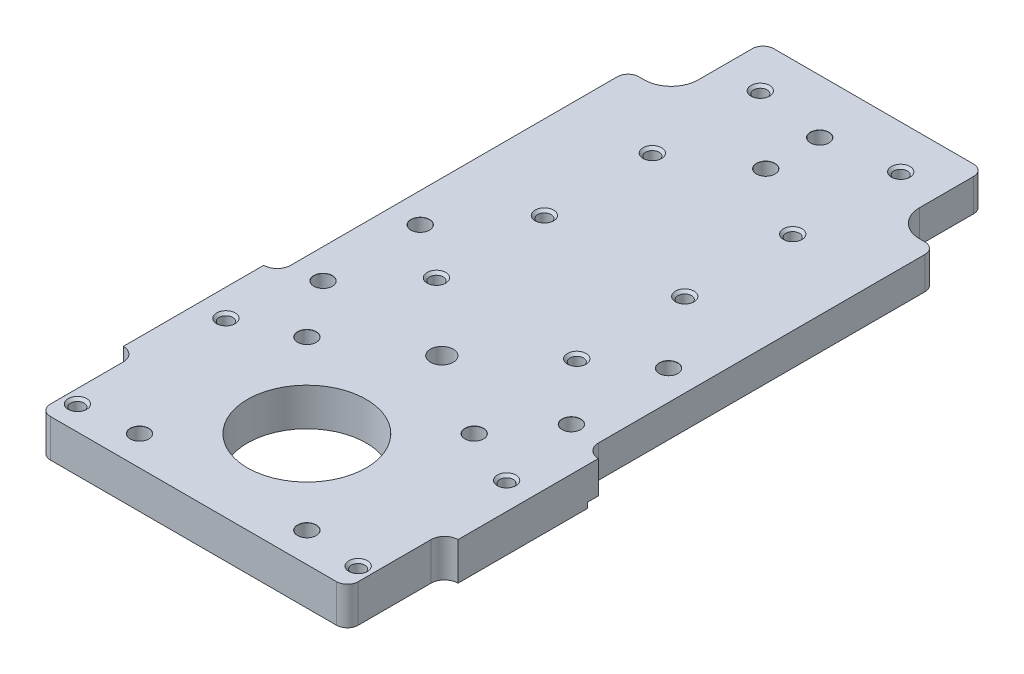
from build123d import *

# Parameters (mm, degrees)
PLATE_MAIN_SKETCH_R             = 11
PLATE_MAIN_SKETCH_R_2           = 2.111650326
EXTRUDE_PLATE_MAIN_DEPTH        = 7
FILLET1_R                       = 2
M3X0_5_TAPPED_HOLE3_AT_2_COUNT  = 2
M3X0_5_TAPPED_HOLE3_AT_2_PITCH  = 27.5
M3X0_5_TAPPED_HOLE3_AT_3_COUNT  = 2
M3X0_5_TAPPED_HOLE3_AT_3_PITCH  = 58.823889705
M3X0_5_TAPPED_HOLE3_AT_4_COUNT  = 2
M3X0_5_TAPPED_HOLE3_AT_4_PITCH  = 66.206117542
M3X0_5_TAPPED_HOLE3_AT_5_COUNT  = 2
M3X0_5_TAPPED_HOLE3_AT_5_PITCH  = 83.20606949
M3X0_5_TAPPED_HOLE3_AT_6_COUNT  = 2
M3X0_5_TAPPED_HOLE3_AT_6_PITCH  = 101.307699609
M3X0_5_TAPPED_HOLE3_AT_7_COUNT  = 2
M3X0_5_TAPPED_HOLE3_AT_7_PITCH  = 120.013540903
M3X0_5_TAPPED_HOLE3_AT_8_COUNT  = 2
M3X0_5_TAPPED_HOLE3_AT_8_PITCH  = 114.242067558
M3X0_5_TAPPED_HOLE3_AT_9_COUNT  = 2
M3X0_5_TAPPED_HOLE3_AT_9_PITCH  = 94.399417371
M3X0_5_TAPPED_HOLE3_AT_10_COUNT = 2
M3X0_5_TAPPED_HOLE3_AT_10_PITCH = 74.640806534
M3X0_5_TAPPED_HOLE3_AT_11_COUNT = 2
M3X0_5_TAPPED_HOLE3_AT_11_PITCH = 55.056788864
M3X0_5_TAPPED_HOLE3_AT_12_COUNT = 2
M3X0_5_TAPPED_HOLE3_AT_12_PITCH = 52
CBORE_FOR_M3_SHCS1_AT_2_COUNT   = 2
CBORE_FOR_M3_SHCS1_AT_2_PITCH   = 31
CBORE_FOR_M3_SHCS1_AT_3_COUNT   = 2
CBORE_FOR_M3_SHCS1_AT_3_PITCH   = 43.840620434
CBORE_FOR_M3_SHCS1_AT_4_COUNT   = 2
CBORE_FOR_M3_SHCS1_AT_4_PITCH   = 31
CBORE_FOR_M3_SHCS1_AT_5_COUNT   = 2
CBORE_FOR_M3_SHCS1_AT_5_PITCH   = 42.172265768
CBORE_FOR_M3_SHCS1_AT_6_COUNT   = 2
CBORE_FOR_M3_SHCS1_AT_6_PITCH   = 56.608303278
CBORE_FOR_M3_SHCS1_AT_7_COUNT   = 2
CBORE_FOR_M3_SHCS1_AT_7_PITCH   = 70.86959856
CBORE_FOR_M3_SHCS1_AT_8_COUNT   = 2
CBORE_FOR_M3_SHCS1_AT_8_PITCH   = 59.970826241
CBORE_FOR_M3_SHCS1_AT_9_COUNT   = 2
CBORE_FOR_M3_SHCS1_AT_9_PITCH   = 101.688249075
CBORE_FOR_M3_SHCS1_AT_10_COUNT  = 2
CBORE_FOR_M3_SHCS1_AT_10_PITCH  = 111.581808553
CUT_RECESS_DEPTH                = 1


with BuildPart() as part:
    # Plate Main Sketch → Extrude Plate Main (new body)
    with BuildSketch(Plane(origin=(-158.085545862, 0, 24.679095537), x_dir=(-1, 0, 0), z_dir=(0, 1, 0))):
        with BuildLine():
            Line((-178.585545862, -24.679095537), (-137.585545862, -24.679095537))
            Line((-137.585545862, -24.679095537), (-137.585545862, -12.679095537))
            ThreePointArc((-137.585545862, -12.679095537), (-136.121079768, -9.143561631), (-132.585545862, -7.679095537))
            Line((-132.585545862, -7.679095537), (-129.585545862, -7.679095537))
            Line((-129.585545862, -7.679095537), (-129.585545862, 54.820904463))
            ThreePointArc((-129.585545862, 54.820904463), (-128.853312815, 56.588671416), (-127.085545862, 57.320904463))
            Line((-127.085545862, 57.320904463), (-127.085545862, 83.320904463))
            ThreePointArc((-127.085545862, 83.320904463), (-128.853312815, 84.05313751), (-129.585545862, 85.820904463))
            Line((-129.585545862, 85.820904463), (-129.585545862, 101.320904463))
            Line((-129.585545862, 101.320904463), (-186.585545862, 101.320904463))
            Line((-186.585545862, 101.320904463), (-186.585545862, 85.820904463))
            ThreePointArc((-186.585545862, 85.820904463), (-187.317778909, 84.05313751), (-189.085545862, 83.320904463))
            Line((-189.085545862, 83.320904463), (-189.085545862, 57.320904463))
            ThreePointArc((-189.085545862, 57.320904463), (-187.317778909, 56.588671416), (-186.585545862, 54.820904463))
            Line((-186.585545862, 54.820904463), (-186.585545862, -7.679095537))
            Line((-186.585545862, -7.679095537), (-183.585545862, -7.679095537))
            ThreePointArc((-183.585545862, -7.679095537), (-180.050011956, -9.143561631), (-178.585545862, -12.679095537))
            Line((-178.585545862, -12.679095537), (-178.585545862, -24.679095537))
        make_face()
        with Locations(Location((-158.085545862, 80.320904463, 0), (0, 0, 90))):
            Circle(PLATE_MAIN_SKETCH_R, mode=Mode.SUBTRACT)
        with Locations(Location((-158.085545862, 55.320904463, 0), (0, 0, 90))):
            Circle(PLATE_MAIN_SKETCH_R_2, mode=Mode.SUBTRACT)
    extrude(amount=EXTRUDE_PLATE_MAIN_DEPTH)

    # Fillet1
    fillet1_edges = [part.edges().sort_by_distance(p)[0] for p in [
        (28.5, 3.5, 126),
        (-28.5, 3.5, 126),
        (-28.5, 3.5, 17),
        (-20.5, 3.5, 0),
        (20.5, 3.5, 0),
        (28.5, 3.5, 17),
    ]]
    fillet(fillet1_edges, radius=FILLET1_R)

    # Sketch13 → M3x0.5 Tapped Hole3 (revolve, cut)
    with BuildSketch(Plane(origin=(26, 0, 121.5), x_dir=(0, 0, -1), z_dir=(1, 0, 0))):
        Polygon((0, 0), (0, 7), (1.725, 7), (1.25, 6.525), (1.25, 0), align=None)
    m3x0_5_tapped_hole3 = revolve(axis=Axis((26, -6.35, 121.5), (0, 1, 0)), mode=Mode.SUBTRACT)

    # M3x0.5 Tapped Hole3 at 2: M3x0.5 Tapped Hole3 ×2
    with Locations(*[(0, 0, -i * M3X0_5_TAPPED_HOLE3_AT_2_PITCH) for i in range(1, M3X0_5_TAPPED_HOLE3_AT_2_COUNT)]):
        add(m3x0_5_tapped_hole3, mode=Mode.SUBTRACT)

    # M3x0.5 Tapped Hole3 at 3: M3x0.5 Tapped Hole3 ×2
    with Locations(*[Vector(-0.8839945855497452, 0, -0.46749713658880765) * (i * M3X0_5_TAPPED_HOLE3_AT_3_PITCH) for i in range(1, M3X0_5_TAPPED_HOLE3_AT_3_COUNT)]):
        add(m3x0_5_tapped_hole3, mode=Mode.SUBTRACT)

    # M3x0.5 Tapped Hole3 at 4: M3x0.5 Tapped Hole3 ×2
    with Locations(*[Vector(-0.5890694311623529, 0, -0.8080824247996377) * (i * M3X0_5_TAPPED_HOLE3_AT_4_PITCH) for i in range(1, M3X0_5_TAPPED_HOLE3_AT_4_COUNT)]):
        add(m3x0_5_tapped_hole3, mode=Mode.SUBTRACT)

    # M3x0.5 Tapped Hole3 at 5: M3x0.5 Tapped Hole3 ×2
    with Locations(*[Vector(-0.46871580689935055, 0, -0.8833490206949294) * (i * M3X0_5_TAPPED_HOLE3_AT_5_PITCH) for i in range(1, M3X0_5_TAPPED_HOLE3_AT_5_COUNT)]):
        add(m3x0_5_tapped_hole3, mode=Mode.SUBTRACT)

    # M3x0.5 Tapped Hole3 at 6: M3x0.5 Tapped Hole3 ×2
    with Locations(*[Vector(-0.38496580369162126, 0, -0.9229308370555532) * (i * M3X0_5_TAPPED_HOLE3_AT_6_PITCH) for i in range(1, M3X0_5_TAPPED_HOLE3_AT_6_COUNT)]):
        add(m3x0_5_tapped_hole3, mode=Mode.SUBTRACT)

    # M3x0.5 Tapped Hole3 at 7: M3x0.5 Tapped Hole3 ×2
    with Locations(*[Vector(-0.32496333085967716, 0, -0.9457266167326497) * (i * M3X0_5_TAPPED_HOLE3_AT_7_PITCH) for i in range(1, M3X0_5_TAPPED_HOLE3_AT_7_COUNT)]):
        add(m3x0_5_tapped_hole3, mode=Mode.SUBTRACT)

    # M3x0.5 Tapped Hole3 at 8: M3x0.5 Tapped Hole3 ×2
    with Locations(*[Vector(-0.113793458730633, 0, -0.993504428148219) * (i * M3X0_5_TAPPED_HOLE3_AT_8_PITCH) for i in range(1, M3X0_5_TAPPED_HOLE3_AT_8_COUNT)]):
        add(m3x0_5_tapped_hole3, mode=Mode.SUBTRACT)

    # M3x0.5 Tapped Hole3 at 9: M3x0.5 Tapped Hole3 ×2
    with Locations(*[Vector(-0.13771271435815216, 0, -0.9904722148067102) * (i * M3X0_5_TAPPED_HOLE3_AT_9_PITCH) for i in range(1, M3X0_5_TAPPED_HOLE3_AT_9_COUNT)]):
        add(m3x0_5_tapped_hole3, mode=Mode.SUBTRACT)

    # M3x0.5 Tapped Hole3 at 10: M3x0.5 Tapped Hole3 ×2
    with Locations(*[Vector(-0.17416746420246676, 0, -0.9847160476062541) * (i * M3X0_5_TAPPED_HOLE3_AT_10_PITCH) for i in range(1, M3X0_5_TAPPED_HOLE3_AT_10_COUNT)]):
        add(m3x0_5_tapped_hole3, mode=Mode.SUBTRACT)

    # M3x0.5 Tapped Hole3 at 11: M3x0.5 Tapped Hole3 ×2
    with Locations(*[Vector(-0.23611983677697992, 0, -0.9717239436591096) * (i * M3X0_5_TAPPED_HOLE3_AT_11_PITCH) for i in range(1, M3X0_5_TAPPED_HOLE3_AT_11_COUNT)]):
        add(m3x0_5_tapped_hole3, mode=Mode.SUBTRACT)

    # M3x0.5 Tapped Hole3 at 12: M3x0.5 Tapped Hole3 ×2
    with Locations(*[(-i * M3X0_5_TAPPED_HOLE3_AT_12_PITCH, 0, 0) for i in range(1, M3X0_5_TAPPED_HOLE3_AT_12_COUNT)]):
        add(m3x0_5_tapped_hole3, mode=Mode.SUBTRACT)

    # Sketch5 → CBORE for M3 SHCS1 (revolve, cut)
    with BuildSketch(Plane(origin=(-15.5, 0, 120.5), x_dir=(0, 0, -1), z_dir=(1, 0, 0))):
        Polygon((0, 0), (0, 7), (1.725, 7), (1.7, 6.975), (1.7, 4.5), (3, 4.5), (3, 0), align=None)
    cbore_for_m3_shcs1 = revolve(axis=Axis((-15.5, -6.35, 120.5), (0, 1, 0)), mode=Mode.SUBTRACT)

    # CBORE for M3 SHCS1 at 2: CBORE for M3 SHCS1 ×2
    with Locations(*[(i * CBORE_FOR_M3_SHCS1_AT_2_PITCH, 0, 0) for i in range(1, CBORE_FOR_M3_SHCS1_AT_2_COUNT)]):
        add(cbore_for_m3_shcs1, mode=Mode.SUBTRACT)

    # CBORE for M3 SHCS1 at 3: CBORE for M3 SHCS1 ×2
    with Locations(*[Vector(0.7071067811865479, 0, -0.7071067811865472) * (i * CBORE_FOR_M3_SHCS1_AT_3_PITCH) for i in range(1, CBORE_FOR_M3_SHCS1_AT_3_COUNT)]):
        add(cbore_for_m3_shcs1, mode=Mode.SUBTRACT)

    # CBORE for M3 SHCS1 at 4: CBORE for M3 SHCS1 ×2
    with Locations(*[(0, 0, -i * CBORE_FOR_M3_SHCS1_AT_4_PITCH) for i in range(1, CBORE_FOR_M3_SHCS1_AT_4_COUNT)]):
        add(cbore_for_m3_shcs1, mode=Mode.SUBTRACT)

    # CBORE for M3 SHCS1 at 5: CBORE for M3 SHCS1 ×2
    with Locations(*[Vector(-0.1778419978967634, 0, -0.9840590550287557) * (i * CBORE_FOR_M3_SHCS1_AT_5_PITCH) for i in range(1, CBORE_FOR_M3_SHCS1_AT_5_COUNT)]):
        add(cbore_for_m3_shcs1, mode=Mode.SUBTRACT)

    # CBORE for M3 SHCS1 at 6: CBORE for M3 SHCS1 ×2
    with Locations(*[Vector(0.6801122409730789, 0, -0.7331080000099417) * (i * CBORE_FOR_M3_SHCS1_AT_6_PITCH) for i in range(1, CBORE_FOR_M3_SHCS1_AT_6_COUNT)]):
        add(cbore_for_m3_shcs1, mode=Mode.SUBTRACT)

    # CBORE for M3 SHCS1 at 7: CBORE for M3 SHCS1 ×2
    with Locations(*[Vector(0.5432512781572745, 0, -0.8395701571521512) * (i * CBORE_FOR_M3_SHCS1_AT_7_PITCH) for i in range(1, CBORE_FOR_M3_SHCS1_AT_7_COUNT)]):
        add(cbore_for_m3_shcs1, mode=Mode.SUBTRACT)

    # CBORE for M3 SHCS1 at 8: CBORE for M3 SHCS1 ×2
    with Locations(*[Vector(-0.12506080823181873, 0, -0.9921490786390946) * (i * CBORE_FOR_M3_SHCS1_AT_8_PITCH) for i in range(1, CBORE_FOR_M3_SHCS1_AT_8_COUNT)]):
        add(cbore_for_m3_shcs1, mode=Mode.SUBTRACT)

    # CBORE for M3 SHCS1 at 9: CBORE for M3 SHCS1 ×2
    with Locations(*[Vector(0.15242665834989907, 0, -0.9883147847848291) * (i * CBORE_FOR_M3_SHCS1_AT_9_PITCH) for i in range(1, CBORE_FOR_M3_SHCS1_AT_9_COUNT)]):
        add(cbore_for_m3_shcs1, mode=Mode.SUBTRACT)

    # CBORE for M3 SHCS1 at 10: CBORE for M3 SHCS1 ×2
    with Locations(*[Vector(0.13891153227375555, 0, -0.9903047945967733) * (i * CBORE_FOR_M3_SHCS1_AT_10_PITCH) for i in range(1, CBORE_FOR_M3_SHCS1_AT_10_COUNT)]):
        add(cbore_for_m3_shcs1, mode=Mode.SUBTRACT)

    # Reccess Sketch → Cut Recess (cut)
    with BuildSketch(Plane(origin=(0, 0, 0), x_dir=(1, 0, 0), z_dir=(0, 1, 0))):
        with BuildLine():
            Line((-8.25, 0), (-8.25, -81))
            ThreePointArc((-8.25, -81), (-9.128679656, -83.121320344), (-11.25, -84))
            Line((-11.25, -84), (-31, -84))
            Line((-31, -84), (-31, 0))
            Line((-31, 0), (-8.25, 0))
        make_face()
        with BuildLine():
            Line((31, 0), (8.25, 0))
            Line((8.25, 0), (8.25, -81))
            ThreePointArc((8.25, -81), (9.128679656, -83.121320344), (11.25, -84))
            Line((11.25, -84), (31, -84))
            Line((31, -84), (31, 0))
        make_face()
    extrude(amount=CUT_RECESS_DEPTH, mode=Mode.SUBTRACT)


solid = part.part
